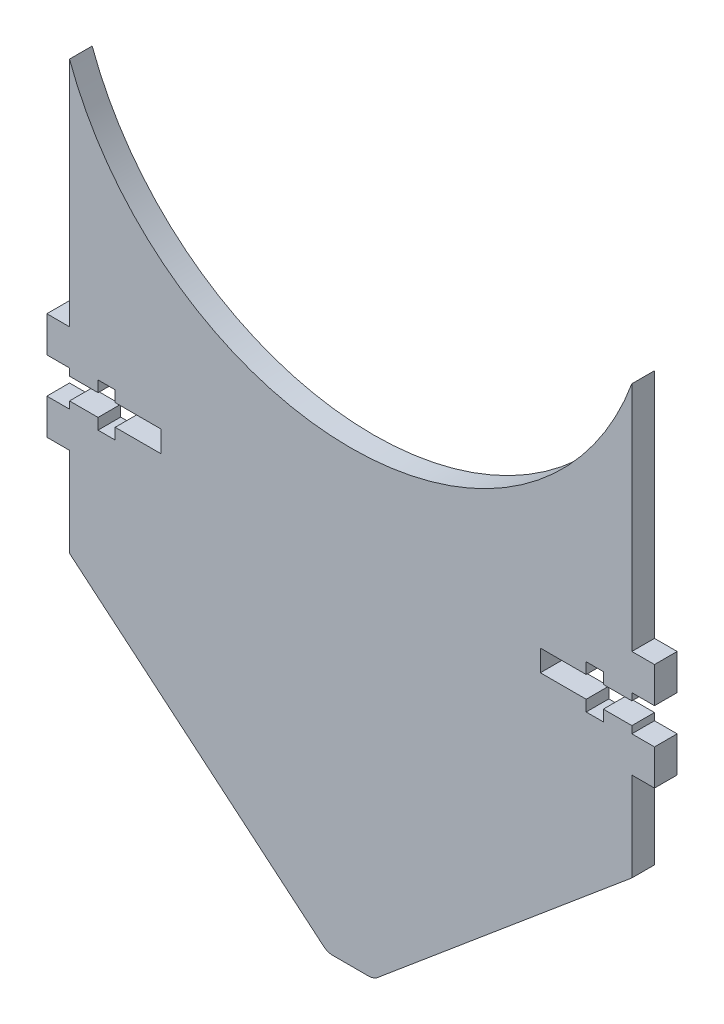
from build123d import *

# Parameters (mm, degrees)
BOSS_EXTRUDE1_DEPTH = 3.175
SKETCH2_W           = 3.175
SKETCH2_H           = 5
BOSS_EXTRUDE2_DEPTH = 3.175
CUT_EXTRUDE1_DEPTH  = 67.034660983


with BuildPart() as part:
    # Sketch1 → Boss-Extrude1 (new body)
    with BuildSketch(Plane.XY):
        with BuildLine():
            Line((39.415, -20), (39.415, 40))
            ThreePointArc((39.415, 40), (0, 12.507162886), (-39.415, 40))
            Line((-39.415, 40), (-39.415, -20))
            Line((-39.415, -20), (-3.785575219, -49.896637192))
            ThreePointArc((-3.785575219, -49.896637192), (-3.184040287, -50.243933548), (-2.5, -50.364548306))
            Line((-2.5, -50.364548306), (2.5, -50.364548306))
            ThreePointArc((2.5, -50.364548306), (3.184040287, -50.243933548), (3.785575219, -49.896637192))
            Line((3.785575219, -49.896637192), (39.415, -20))
        make_face()
    extrude(amount=BOSS_EXTRUDE1_DEPTH)

    # Sketch2 → Boss-Extrude2 (add)
    with BuildSketch(Plane.XY.offset(3.175)):
        with Locations((41.0025, -5)):
            Rectangle(SKETCH2_W, SKETCH2_H)
        with Locations((41.0025, 5)):
            Rectangle(SKETCH2_W, SKETCH2_H)
        with Locations((-41.0025, 5)):
            Rectangle(SKETCH2_W, SKETCH2_H)
        with Locations((-41.0025, -5)):
            Rectangle(SKETCH2_W, SKETCH2_H)
    extrude(amount=-BOSS_EXTRUDE2_DEPTH)

    # Sketch3 → Cut-Extrude1 (cut, through all)
    with BuildSketch(Plane.XY.offset(3.175)):
        Polygon((39.415, 1.5), (35.415, 1.5), (35.415, 3.05), (33.015, 3.05), (33.015, 1.5), (26.59, 1.5), (26.59, -1.5), (33.015, -1.5), (33.015, -3.05), (35.415, -3.05), (35.415, -1.5), (39.415, -1.5), align=None)
        Polygon((-39.415, -1.5), (-35.415, -1.5), (-35.415, -3.05), (-33.015, -3.05), (-33.015, -1.5), (-26.59, -1.5), (-26.59, 1.5), (-33.015, 1.5), (-33.015, 3.05), (-35.415, 3.05), (-35.415, 1.5), (-39.415, 1.5), align=None)
    extrude(amount=-CUT_EXTRUDE1_DEPTH, mode=Mode.SUBTRACT)


solid = part.part
